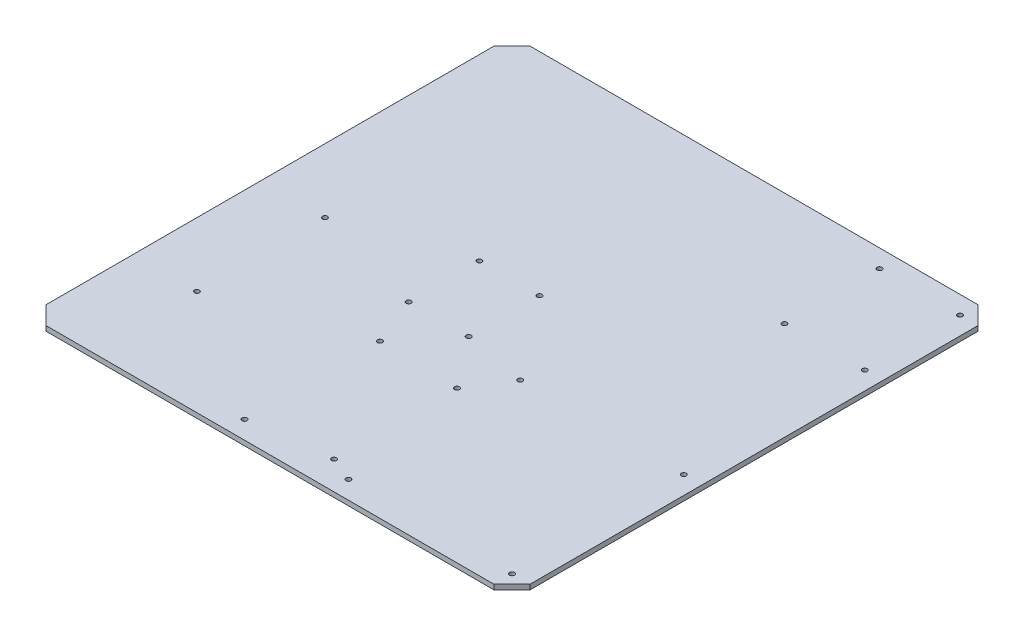
from build123d import *

# Parameters (mm, degrees)
SKETCH1_R           = 1.5
BOSS_EXTRUDE1_DEPTH = 1.5


with BuildPart() as part:
    # Sketch1 → Boss-Extrude1 (new, symmetric)
    with BuildSketch(Plane(origin=(0, 0, 0), x_dir=(1, 0, 0), z_dir=(0, 1, 0))):
        Polygon((-147.5, 136.5), (-136.5, 147.5), (136.5, 147.5), (147.5, 136.5), (147.5, -136.5), (136.5, -147.5), (-136.5, -147.5), (-147.5, -136.5), align=None)
        with Locations(Location((-26.5, -136.5, 0), (0, 0, 270))):
            Circle(SKETCH1_R, mode=Mode.SUBTRACT)
        with Locations(Location((-26.5, -54, 0), (0, 0, 270))):
            Circle(SKETCH1_R, mode=Mode.SUBTRACT)
        with Locations(Location((21.8, -55.3, 0), (0, 0, 270))):
            Circle(SKETCH1_R, mode=Mode.SUBTRACT)
        with Locations(Location((21.8, -130.2, 0), (0, 0, 270))):
            Circle(SKETCH1_R, mode=Mode.SUBTRACT)
        with Locations(Location((-108.5, -83.5, 0), (0, 0, 270))):
            Circle(SKETCH1_R, mode=Mode.SUBTRACT)
        with Locations(Location((-108.5, -5.5, 0), (0, 0, 270))):
            Circle(SKETCH1_R, mode=Mode.SUBTRACT)
        with Locations(Location((-38.5, -24.5, 0), (0, 0, 270))):
            Circle(SKETCH1_R, mode=Mode.SUBTRACT)
        with Locations(Location((-1.92, 18.68, 0), (0, 0, 270))):
            Circle(SKETCH1_R, mode=Mode.SUBTRACT)
        with Locations(Location((-38.5, 18.68, 0), (0, 0, 270))):
            Circle(SKETCH1_R, mode=Mode.SUBTRACT)
        with Locations(Location((-1.92, -24.5, 0), (0, 0, 270))):
            Circle(SKETCH1_R, mode=Mode.SUBTRACT)
        with Locations(Location((136.5, 136.5, 0), (0, 0, 270))):
            Circle(SKETCH1_R, mode=Mode.SUBTRACT)
        with Locations(Location((87.5, 136.5, 0), (0, 0, 270))):
            Circle(SKETCH1_R, mode=Mode.SUBTRACT)
        with Locations(Location((87.5, 78.5, 0), (0, 0, 270))):
            Circle(SKETCH1_R, mode=Mode.SUBTRACT)
        with Locations(Location((136.5, 78.5, 0), (0, 0, 270))):
            Circle(SKETCH1_R, mode=Mode.SUBTRACT)
        with Locations(Location((136.5, -136.5, 0), (0, 0, 270))):
            Circle(SKETCH1_R, mode=Mode.SUBTRACT)
        with Locations(Location((36.8, -136.5, 0), (0, 0, 270))):
            Circle(SKETCH1_R, mode=Mode.SUBTRACT)
        with Locations(Location((36.8, -31.8, 0), (0, 0, 270))):
            Circle(SKETCH1_R, mode=Mode.SUBTRACT)
        with Locations(Location((136.5, -31.8, 0), (0, 0, 270))):
            Circle(SKETCH1_R, mode=Mode.SUBTRACT)
    extrude(amount=BOSS_EXTRUDE1_DEPTH, both=True)


solid = part.part
